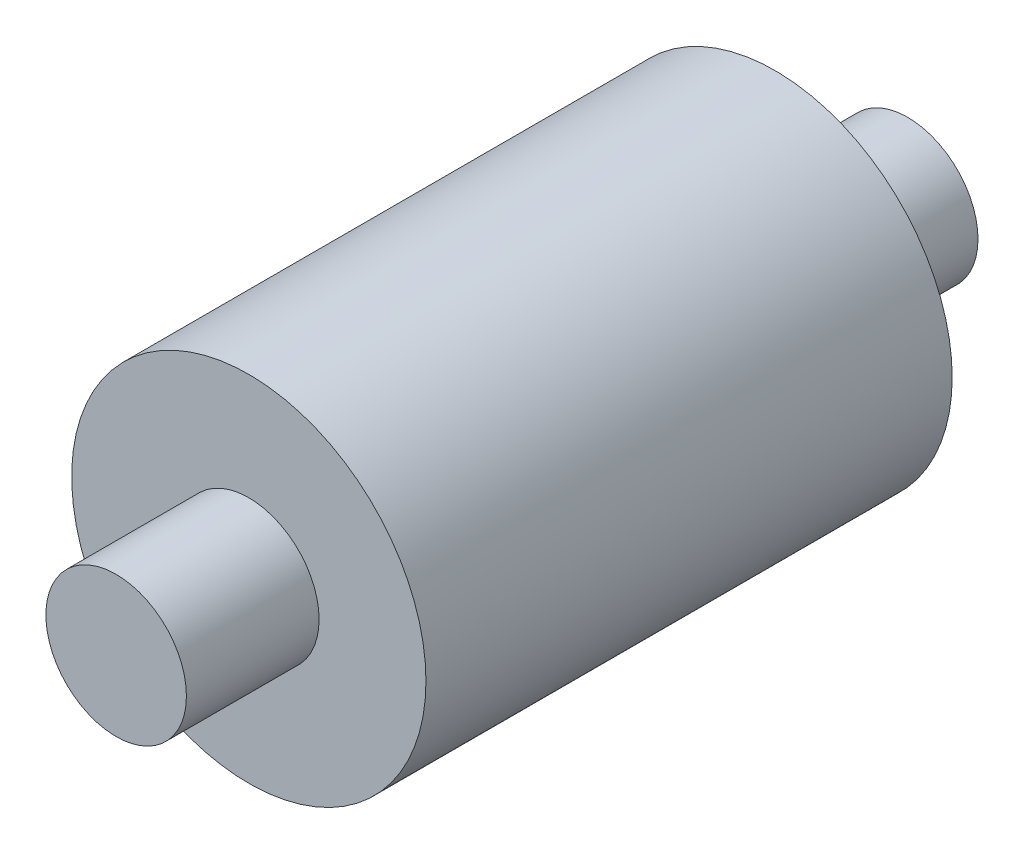
from build123d import *

# Parameters (mm, degrees)
SKETCH1_R           = 1.5875
BOSS_EXTRUDE1_DEPTH = 17.8816
SKETCH2_R           = 4.0015
BOSS_EXTRUDE2_DEPTH = 11.8872


with BuildPart() as part:
    # Sketch1 → Boss-Extrude1 (new body)
    with BuildSketch(Plane.XY):
        Circle(SKETCH1_R)
    extrude(amount=-BOSS_EXTRUDE1_DEPTH)

    # Sketch2 → Boss-Extrude2 (add)
    with BuildSketch(Plane.XY.offset(-2.9972)):
        Circle(SKETCH2_R)
    extrude(amount=-BOSS_EXTRUDE2_DEPTH)


solid = part.part
